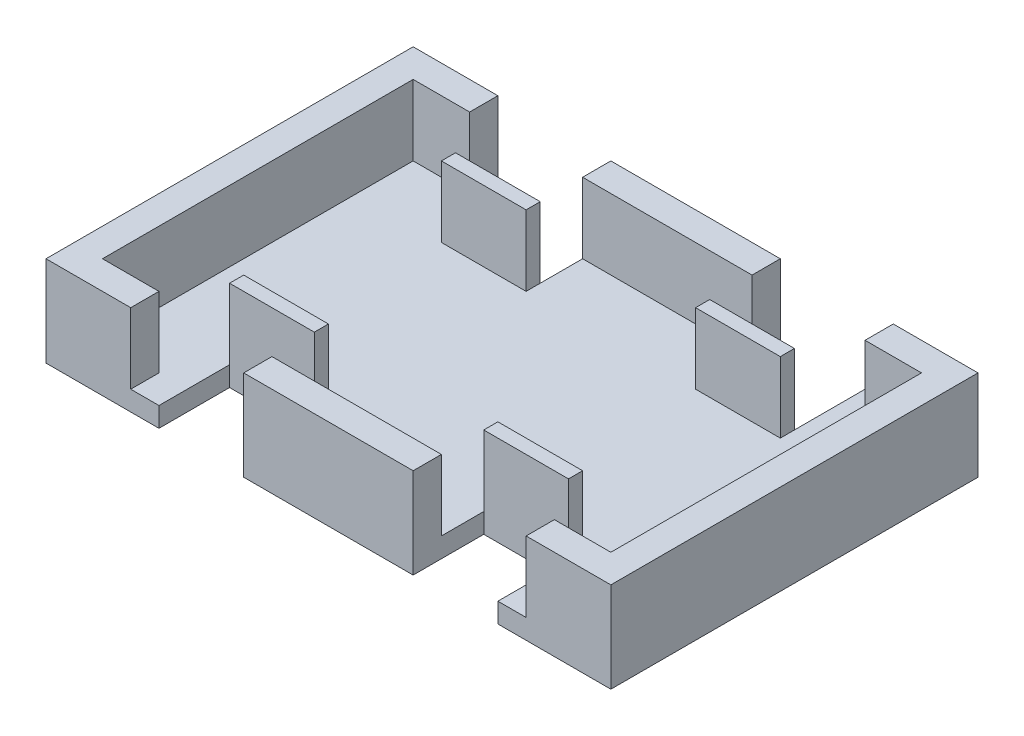
from build123d import *

# Parameters (mm, degrees)
EXTRUDE_1_DEPTH      = 5
EXTRUDE_1_DEPTH_BACK = 2
SKETCH_2_W           = 30
SKETCH_2_H           = 5
EXTRUDE_2_DEPTH      = 25
SKETCH_3_W           = 60
SKETCH_3_H           = 10
EXTRUDE_3_DEPTH      = 25


with BuildPart() as part:
    # 草圖1 → 填料-伸長1 (new, two sides: drawn at the far end of the back side and taken through both)
    with BuildSketch(Plane(origin=(0, 0, 0), x_dir=(1, 0, 0), z_dir=(0, 1, 0)).offset(-EXTRUDE_1_DEPTH_BACK)):
        Polygon((-60, 65), (-60, 40), (-30, 40), (-30, 65), (30, 65), (30, 40), (60, 40), (60, 65), (100, 65), (100, -65), (60, -65), (60, -40), (30, -40), (30, -65), (-30, -65), (-30, -40), (-60, -40), (-60, -65), (-100, -65), (-100, 65), align=None)
    extrude(amount=EXTRUDE_1_DEPTH + EXTRUDE_1_DEPTH_BACK)

    # 草圖2 → 填料-伸長2 (add)
    with BuildSketch(Plane(origin=(0, 5, 0), x_dir=(1, 0, 0), z_dir=(0, 1, 0))):
        with Locations((-45, 37.5)):
            Rectangle(SKETCH_2_W, SKETCH_2_H)
        with Locations((-45, -37.5)):
            Rectangle(SKETCH_2_W, SKETCH_2_H)
        with Locations((45, -37.5)):
            Rectangle(SKETCH_2_W, SKETCH_2_H)
        with Locations((45, 37.5)):
            Rectangle(SKETCH_2_W, SKETCH_2_H)
    extrude(amount=EXTRUDE_2_DEPTH)

    # 草圖3 → 填料-伸長3 (add)
    with BuildSketch(Plane(origin=(0, 5, 0), x_dir=(1, 0, 0), z_dir=(0, 1, 0))):
        Polygon((70, -65), (100, -65), (100, 65), (70, 65), (70, 55), (90, 55), (90, -55), (70, -55), align=None)
        with Locations((0, 60)):
            Rectangle(SKETCH_3_W, SKETCH_3_H)
        with Locations((0, -60)):
            Rectangle(SKETCH_3_W, SKETCH_3_H)
        Polygon((-100, 65), (-100, -65), (-70, -65), (-70, -55), (-90, -55), (-90, 55), (-70, 55), (-70, 65), align=None)
    extrude(amount=EXTRUDE_3_DEPTH)


solid = part.part
